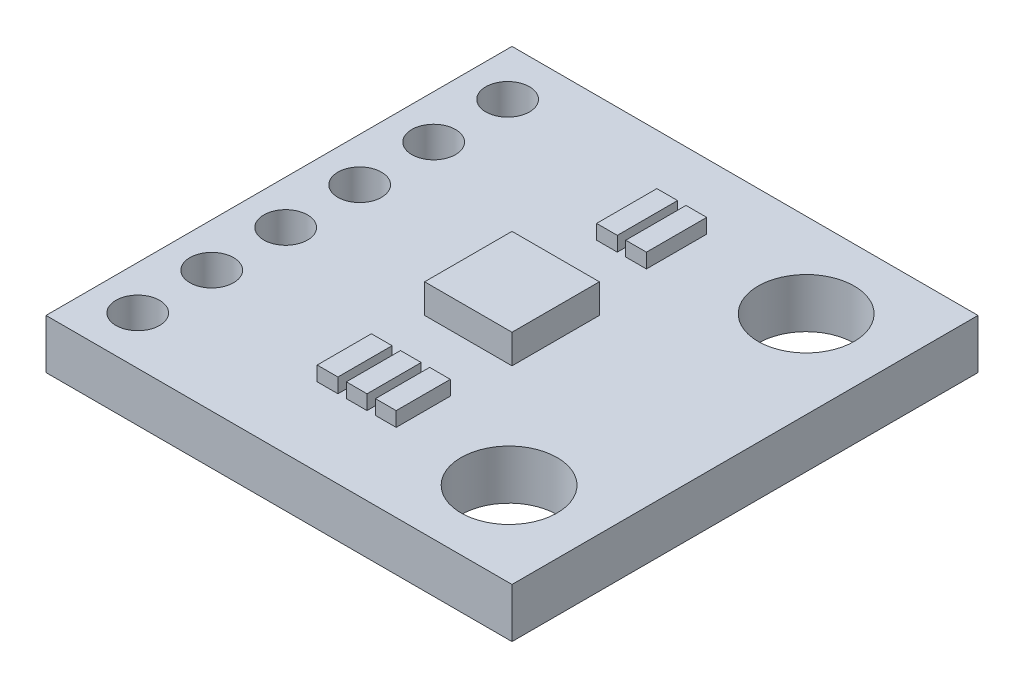
from build123d import *

# Parameters (mm, degrees)
SKETCH2_W           = 16
SKETCH2_H           = 16
BOSS_EXTRUDE1_DEPTH = 1.7
SKETCH3_R           = 0.75
CUT_EXTRUDE1_DEPTH  = 1.7
SKETCH4_W           = 3
SKETCH4_H           = 3
BOSS_EXTRUDE2_DEPTH = 1
SKETCH5_W           = 0.710598353
SKETCH5_H           = 2.069095202
SKETCH5_H_2         = 1.860095687
BOSS_EXTRUDE3_DEPTH = 0.5
SKETCH6_R           = 1.65
CUT_EXTRUDE2_DEPTH  = 12.440716761


with BuildPart() as part:
    # Sketch2 → Boss-Extrude1 (new body)
    with BuildSketch(Plane(origin=(0, 0, 0), x_dir=(1, 0, 0), z_dir=(0, 1, 0))):
        Rectangle(SKETCH2_W, SKETCH2_H)
    extrude(amount=BOSS_EXTRUDE1_DEPTH)

    # Sketch3 → Cut-Extrude1 (cut)
    with BuildSketch(Plane(origin=(0, 1.7, 0), x_dir=(1, 0, 0), z_dir=(0, 1, 0))):
        with Locations(Location((-6.5, 6.35, 0), (0, 0, 270))):
            Circle(SKETCH3_R)
        with Locations(Location((-6.5, 3.81, 0), (0, 0, 270))):
            Circle(SKETCH3_R)
        with Locations(Location((-6.5, 1.27, 0), (0, 0, 270))):
            Circle(SKETCH3_R)
        with Locations(Location((-6.5, -1.27, 0), (0, 0, 270))):
            Circle(SKETCH3_R)
        with Locations(Location((-6.5, -3.81, 0), (0, 0, 270))):
            Circle(SKETCH3_R)
        with Locations(Location((-6.5, -6.35, 0), (0, 0, 270))):
            Circle(SKETCH3_R)
    extrude(amount=-CUT_EXTRUDE1_DEPTH, mode=Mode.SUBTRACT)

    # Sketch4 → Boss-Extrude2 (add)
    with BuildSketch(Plane(origin=(0, 1.7, 0), x_dir=(1, 0, 0), z_dir=(0, 1, 0))):
        Rectangle(SKETCH4_W, SKETCH4_H)
    extrude(amount=BOSS_EXTRUDE2_DEPTH)

    # Sketch5 → Boss-Extrude3 (add)
    with BuildSketch(Plane(origin=(0, 1.7, 0), x_dir=(1, 0, 0), z_dir=(0, 1, 0))):
        with Locations((0.571550994, 4.723389047)):
            Rectangle(SKETCH5_W, SKETCH5_H)
        with Locations((-0.428449007, 4.723389047)):
            Rectangle(SKETCH5_W, SKETCH5_H)
        with Locations((-1.01364765, -4.388989823)):
            Rectangle(SKETCH5_W, SKETCH5_H_2)
        with Locations((-0.013647649, -4.388989823)):
            Rectangle(SKETCH5_W, SKETCH5_H_2)
        with Locations((0.986352351, -4.388989823)):
            Rectangle(SKETCH5_W, SKETCH5_H_2)
    extrude(amount=BOSS_EXTRUDE3_DEPTH)

    # Sketch6 → Cut-Extrude2 (cut, through all)
    with BuildSketch(Plane(origin=(0, 1.7, 0), x_dir=(1, 0, 0), z_dir=(0, 1, 0))):
        with Locations(Location((5, 5.1, 0), (0, 0, 270))):
            Circle(SKETCH6_R)
        with Locations(Location((5, -5.1, 0), (0, 0, 90))):
            Circle(SKETCH6_R)
    extrude(amount=-CUT_EXTRUDE2_DEPTH, mode=Mode.SUBTRACT)


solid = part.part
